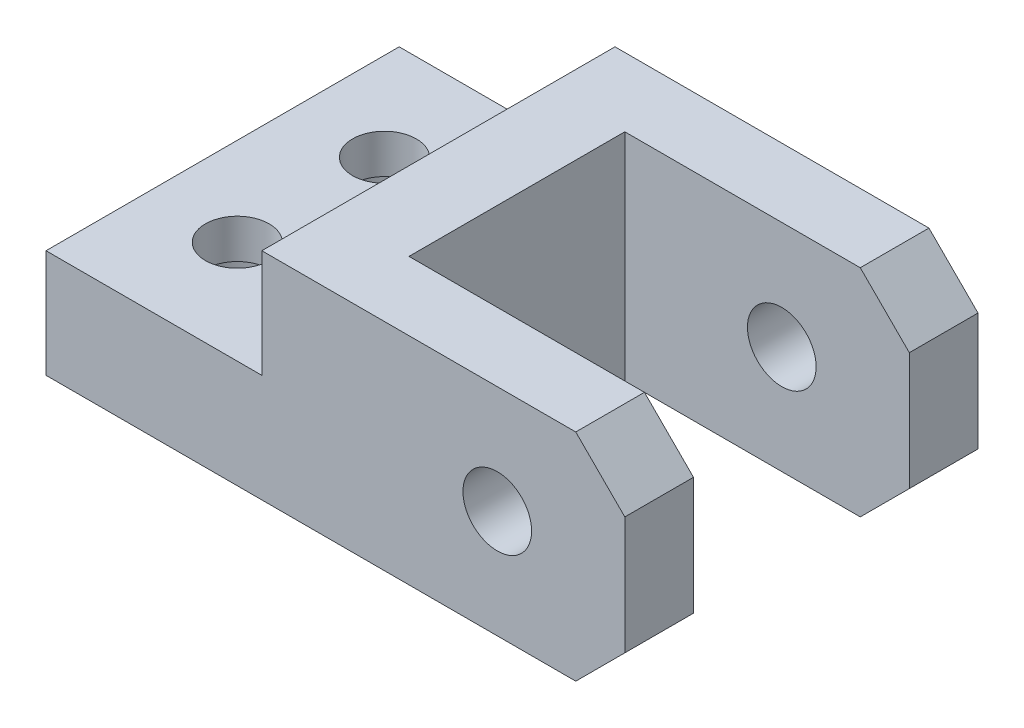
from build123d import *

# Parameters (mm, degrees)
ESQUISSE1_R                                     = 3.5
BASE_EXTRUSION_DEPTH                            = 36
CHAMBRAGE_POUR_VIS_T_TE_CYLINDRIQUE_D           = 6.5
CHAMBRAGE_POUR_VIS_T_TE_CYLINDRIQUE_CBORE_D     = 12
CHAMBRAGE_POUR_VIS_T_TE_CYLINDRIQUE_CBORE_DEPTH = 7
ENL_V_MAT_EXTRU_1_DEPTH                         = 29


with BuildPart() as part:
    # Esquisse1 → Base-Extrusion (new body)
    with BuildSketch(Plane.XY):
        Polygon((0, 0), (0, 11), (32, 11), (37, 6), (37, -6), (32, -11), (-22, -11), (-22, 0), align=None)
        with Locations((24, 0)):
            Circle(ESQUISSE1_R, mode=Mode.SUBTRACT)
    extrude(amount=-BASE_EXTRUSION_DEPTH)

    # Chambrage pour vis à tête cylindrique à 6 pans creux (vis CHC) M51 (through all)
    with Locations(Plane.XZ.offset(11)):
        with Locations((-13, -25.5), (-13, -10.5)):
            CounterBoreHole(CHAMBRAGE_POUR_VIS_T_TE_CYLINDRIQUE_D / 2, CHAMBRAGE_POUR_VIS_T_TE_CYLINDRIQUE_CBORE_D / 2, CHAMBRAGE_POUR_VIS_T_TE_CYLINDRIQUE_CBORE_DEPTH)

    # Esquisse4 → Enlèv. mat.-Extru.1 (cut)
    with BuildSketch(Plane(origin=(37, 0, 0), x_dir=(0, 0, -1), z_dir=(1, 0, 0))):
        Polygon((29, -12.973294334), (18, -12.973294334), (7, -12.973294334), (7, 12.026705666), (18, 12.026705666), (29, 12.026705666), align=None)
    extrude(amount=-ENL_V_MAT_EXTRU_1_DEPTH, mode=Mode.SUBTRACT)


solid = part.part
